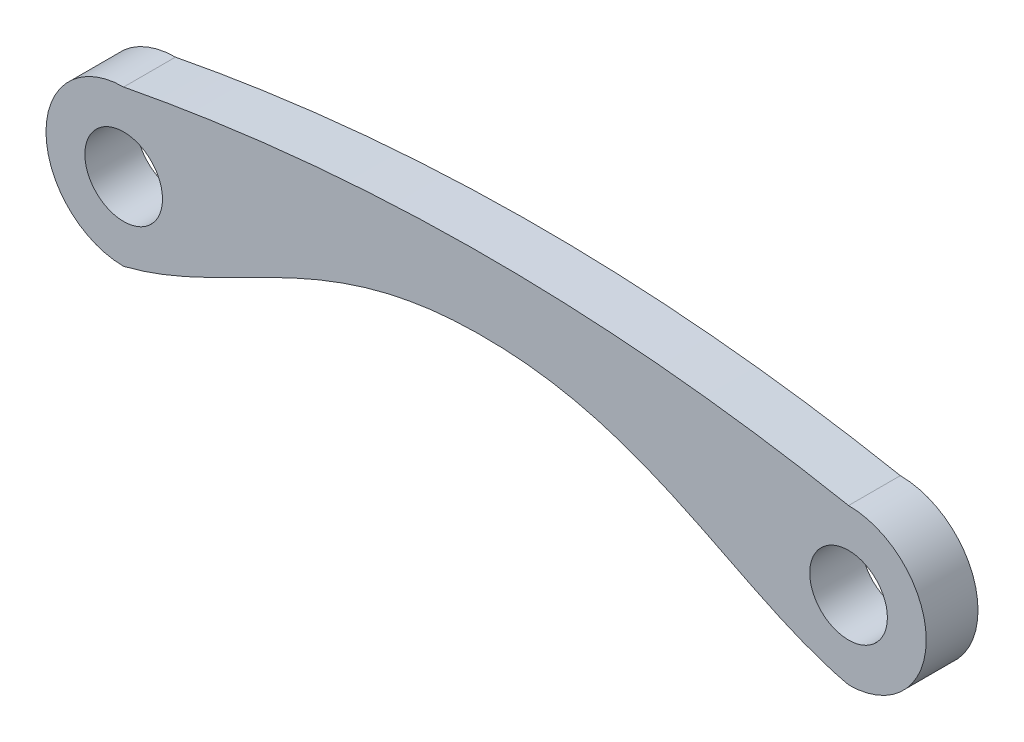
from build123d import *

# Parameters (mm, degrees)
SKETCH1_R           = 1.5
BOSS_EXTRUDE1_DEPTH = 2


with BuildPart() as part:
    # Sketch1 → Boss-Extrude1 (new body)
    with BuildSketch(Plane.XY):
        with BuildLine():
            ThreePointArc((-14, 3), (-17, 0), (-14, -3))
            add(Edge.make_bspline(
                [(-14, -3), (-10.110775288, -2.025488943), (-6.332313911, 1.681383892), (6.35903931, 1.579555666), (10.137986604, -2.11235599), (14, -3)],
                knots=[0, 0, 0, 0, 0.449202302, 0.549202302, 1, 1, 1, 1], degree=3))
            ThreePointArc((14, -3), (17, 0), (14, 3))
            add(Edge.make_bspline(
                [(-14, 3), (0, 5.7), (14, 3)],
                knots=[0, 0, 0, 1, 1, 1], degree=2))
        make_face()
        with Locations((-14, 0)):
            Circle(SKETCH1_R, mode=Mode.SUBTRACT)
        with Locations((14, 0)):
            Circle(SKETCH1_R, mode=Mode.SUBTRACT)
    extrude(amount=BOSS_EXTRUDE1_DEPTH)


solid = part.part
